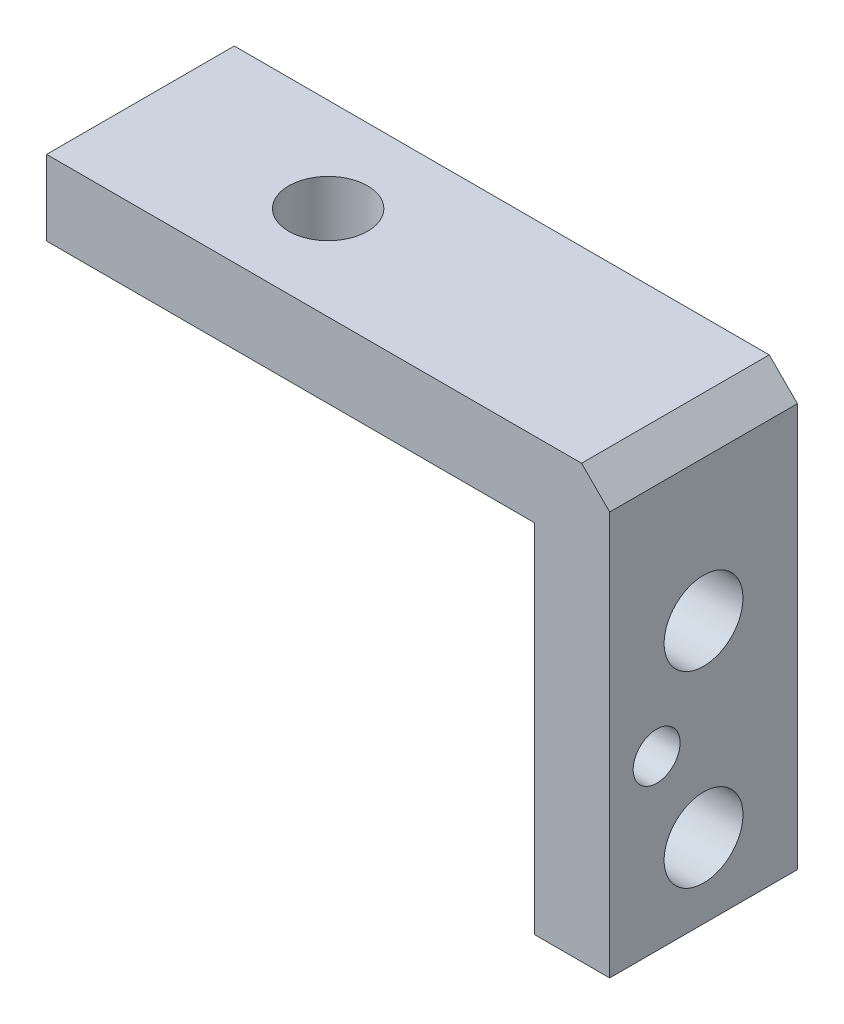
from build123d import *

# Parameters (mm, degrees)
SKETCH1_W                          = 30
SKETCH1_H                          = 23
BOSS_EXTRUDE1_DEPTH                = 5
SKETCH2_W                          = 26
SKETCH2_H                          = 19
CUT_EXTRUDE1_DEPTH                 = 22.38340478
CHAMFER1_SIZE                      = 1.5
TAPPED_HOLE_FOR_M4X0_7_HELICOIL1_D = 4.2
M4_CLEARANCE_HOLE1_D               = 4.2
M3_TAPPED_HOLE1_D                  = 2.5


with BuildPart() as part:
    # Sketch1 → Boss-Extrude1 (new, symmetric)
    with BuildSketch(Plane.XY):
        Rectangle(SKETCH1_W, SKETCH1_H)
    extrude(amount=BOSS_EXTRUDE1_DEPTH, both=True)

    # Sketch2 → Cut-Extrude1 (cut, through all)
    with BuildSketch(Plane.XY.offset(5)):
        with Locations((-2, -2)):
            Rectangle(SKETCH2_W, SKETCH2_H)
    extrude(amount=-CUT_EXTRUDE1_DEPTH, mode=Mode.SUBTRACT)

    # Chamfer1
    chamfer1_edges = [part.edges().sort_by_distance(p)[0] for p in [
        (15, 11.5, 0),
    ]]
    chamfer(chamfer1_edges, length=CHAMFER1_SIZE)

    # Tapped Hole for M4x0.7 Helicoil1 (through all)
    with Locations(Plane(origin=(0, 11.5, 0), x_dir=(1, 0, 0), z_dir=(0, 1, 0))):
        with Locations((-5, 0)):
            Hole(TAPPED_HOLE_FOR_M4X0_7_HELICOIL1_D / 2)

    # M4 Clearance Hole1 (through all)
    with Locations(Plane(origin=(15, 0, 0), x_dir=(0, 0, -1), z_dir=(1, 0, 0))):
        with Locations((0, -7.517), (0, 2.483)):
            Hole(M4_CLEARANCE_HOLE1_D / 2)

    # M3 Tapped Hole1 (through all)
    with Locations(Plane(origin=(15, 0, 0), x_dir=(0, 0, -1), z_dir=(1, 0, 0))):
        with Locations((-2.5, -2.517)):
            Hole(M3_TAPPED_HOLE1_D / 2)


solid = part.part
